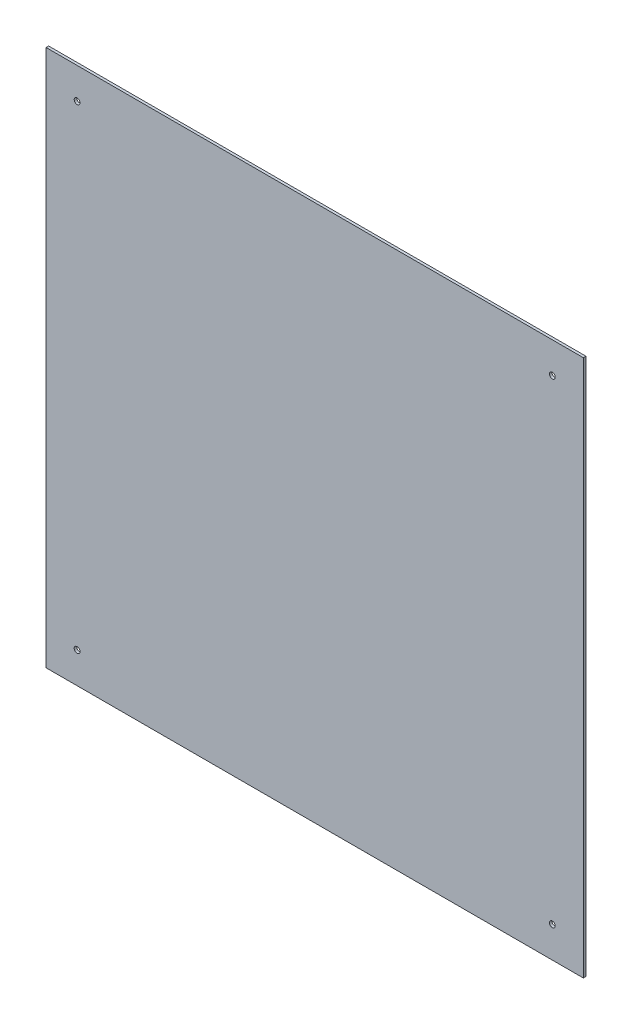
from build123d import *

# Parameters (mm, degrees)
SKETCH1_W           = 660.4
SKETCH1_H           = 660.4
SKETCH1_R           = 3.556
BOSS_EXTRUDE1_DEPTH = 3.175


with BuildPart() as part:
    # Sketch1 → Boss-Extrude1 (new body)
    with BuildSketch(Plane.XY):
        with Locations((330.2, 330.2)):
            Rectangle(SKETCH1_W, SKETCH1_H)
        with Locations((38.1, 622.3)):
            Circle(SKETCH1_R, mode=Mode.SUBTRACT)
        with Locations((622.3, 622.3)):
            Circle(SKETCH1_R, mode=Mode.SUBTRACT)
        with Locations((622.3, 38.1)):
            Circle(SKETCH1_R, mode=Mode.SUBTRACT)
        with Locations((38.1, 38.1)):
            Circle(SKETCH1_R, mode=Mode.SUBTRACT)
    extrude(amount=BOSS_EXTRUDE1_DEPTH)


solid = part.part
